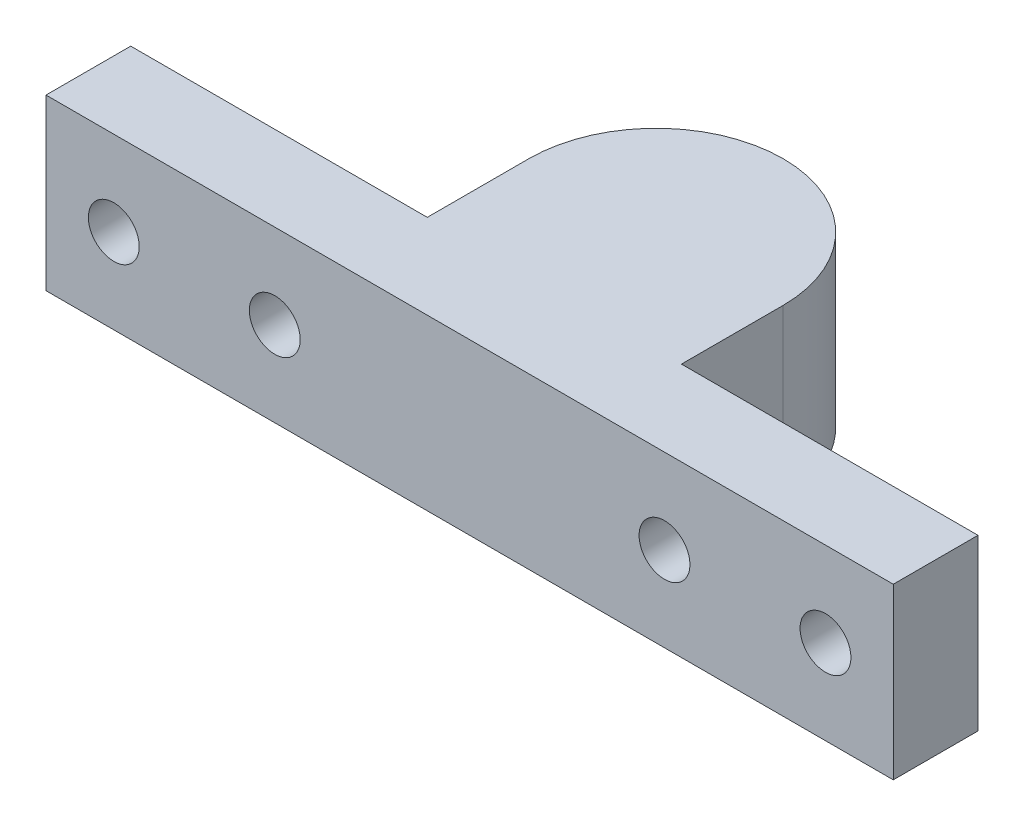
from build123d import *

# Parameters (mm, degrees)
DODANIE_WYCI_GNI_CIE1_DEPTH = 10
SZKIC5_R                    = 1.5
WYTNIJ_WYCI_GNI_CIE2_DEPTH  = 5
SZKIC6_W                    = 7.995239892
SZKIC6_H                    = 7.995239892
WYTNIJ_WYCI_GNI_CIE3_DEPTH  = 6.5


with BuildPart() as part:
    # Szkic1 → Dodanie-wyciągnięcie1 (new body)
    with BuildSketch(Plane(origin=(0, 0, 0), x_dir=(1, 0, 0), z_dir=(0, 1, 0))):
        with BuildLine():
            Line((-25, 0), (25, 0))
            Line((25, 0), (25, 5))
            Line((25, 5), (7.5, 5))
            Line((7.5, 5), (7.5, 11))
            ThreePointArc((7.5, 11), (0, 18.5), (-7.5, 11))
            Line((-7.5, 11), (-7.5, 5))
            Line((-7.5, 5), (-25, 5))
            Line((-25, 5), (-25, 0))
        make_face()
    extrude(amount=DODANIE_WYCI_GNI_CIE1_DEPTH)

    # Szkic5 → Wytnij-wyciągnięcie2 (cut)
    with BuildSketch(Plane(origin=(0, 0, -5), x_dir=(-1, 0, 0), z_dir=(0, 0, -1))):
        with Locations((-21, 5)):
            Circle(SZKIC5_R)
        with Locations((-11.5, 5)):
            Circle(SZKIC5_R)
        with Locations((11.5, 5)):
            Circle(SZKIC5_R)
        with Locations((21, 5)):
            Circle(SZKIC5_R)
    extrude(amount=-WYTNIJ_WYCI_GNI_CIE2_DEPTH, mode=Mode.SUBTRACT)

    # Szkic6 → Wytnij-wyciągnięcie3 (cut)
    with BuildSketch(Plane.XZ):
        with Locations((0, -11)):
            Rectangle(SZKIC6_W, SZKIC6_H)
    extrude(amount=-WYTNIJ_WYCI_GNI_CIE3_DEPTH, mode=Mode.SUBTRACT)


solid = part.part
